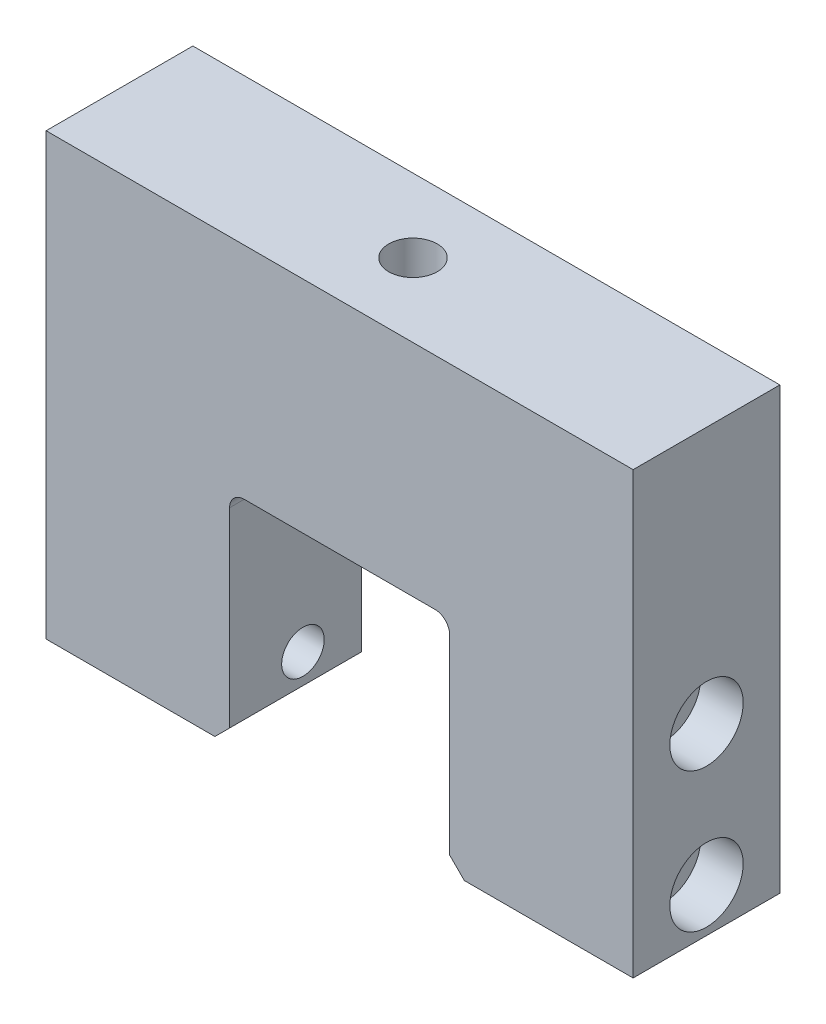
from build123d import *

# Parameters (mm, degrees)
SKETCH1_W                                            = 40
SKETCH1_H                                            = 30
BOSS_EXTRUDE1_DEPTH                                  = 10
SKETCH2_W                                            = 15
SKETCH2_H                                            = 15
CUT_EXTRUDE1_DEPTH                                   = 27.925824036
CBORE_FOR_M2_5_SLOTTED_CHEESE_HEAD_SCREW_D           = 2.9
CBORE_FOR_M2_5_SLOTTED_CHEESE_HEAD_SCREW_DEPTH       = 12.5
CBORE_FOR_M2_5_SLOTTED_CHEESE_HEAD_SCREW_CBORE_D     = 5
CBORE_FOR_M2_5_SLOTTED_CHEESE_HEAD_SCREW_CBORE_DEPTH = 2.9
M4_TAPPED_HOLE1_D                                    = 3.3
M4_TAPPED_HOLE1_DEPTH                                = 5
M4_TAPPED_HOLE1_TIP                                  = 0.991420021
FILLET1_R                                            = 1
CHAMFER1_SIZE                                        = 1
CHAMFER2_SIZE                                        = 1
M4_TAPPED_HOLE2_D                                    = 3.3


with BuildPart() as part:
    # Sketch1 → Boss-Extrude1 (new body)
    with BuildSketch(Plane.XY):
        Rectangle(SKETCH1_W, SKETCH1_H)
    extrude(amount=BOSS_EXTRUDE1_DEPTH)

    # Sketch2 → Cut-Extrude1 (cut, through all)
    with BuildSketch(Plane.XY.offset(10)):
        with Locations((0, -7.5)):
            Rectangle(SKETCH2_W, SKETCH2_H)
    extrude(amount=-CUT_EXTRUDE1_DEPTH, mode=Mode.SUBTRACT)

    # CBORE for M2.5 Slotted cheese head screws2
    with Locations(Plane.ZY.offset(20)):
        with Locations((5, -2.5), (5, -12)):
            cbore_for_m2_5_slotted_cheese_head_screw = CounterBoreHole(CBORE_FOR_M2_5_SLOTTED_CHEESE_HEAD_SCREW_D / 2, CBORE_FOR_M2_5_SLOTTED_CHEESE_HEAD_SCREW_CBORE_D / 2, CBORE_FOR_M2_5_SLOTTED_CHEESE_HEAD_SCREW_CBORE_DEPTH, depth=CBORE_FOR_M2_5_SLOTTED_CHEESE_HEAD_SCREW_DEPTH)

    # Mirror1: CBORE for M2.5 Slotted cheese head screws2 across plane
    add(cbore_for_m2_5_slotted_cheese_head_screw.mirror(Plane(origin=(0, 0, 0), x_dir=(0, 0, 1), z_dir=(1, 0, 0))), mode=Mode.SUBTRACT)

    # M4 Tapped Hole1
    with Locations(Plane(origin=(0, 0, 0), x_dir=(-1, 0, 0), z_dir=(0, 0, -1))):
        with Locations((-13.75, -7), (-13.75, 11), (13.75, 11), (13.75, -7)):
            Hole(M4_TAPPED_HOLE1_D / 2, depth=M4_TAPPED_HOLE1_DEPTH)
            with Locations((0, 0, -(M4_TAPPED_HOLE1_DEPTH + M4_TAPPED_HOLE1_TIP / 2))):  # 118° drill point
                Cone(0, M4_TAPPED_HOLE1_D / 2, M4_TAPPED_HOLE1_TIP, mode=Mode.SUBTRACT)

    # Fillet1
    fillet1_edges = [part.edges().sort_by_distance(p)[0] for p in [
        (7.5, 0, 5),
        (-7.5, 0, 5),
    ]]
    fillet(fillet1_edges, radius=FILLET1_R)

    # Chamfer1
    chamfer1_edges = [part.edges().sort_by_distance(p)[0] for p in [
        (7.5, -15, 5),
        (-7.5, -15, 5),
    ]]
    chamfer(chamfer1_edges, length=CHAMFER1_SIZE)

    # Chamfer2
    chamfer2_edges = [part.edges().sort_by_distance(p)[0] for p in [
        (7.5, -7.5, 0),
        (-7.5, -7.5, 0),
        (7.207106781, -0.292893219, 0),
        (-7.207106781, -0.292893219, 0),
        (0, 0, 0),
    ]]
    chamfer(chamfer2_edges, length=CHAMFER2_SIZE)

    # M4 Tapped Hole2 (through all)
    with Locations(Plane(origin=(0, 15, 0), x_dir=(1, 0, 0), z_dir=(0, 1, 0))):
        with Locations((0, -5)):
            Hole(M4_TAPPED_HOLE2_D / 2)


solid = part.part
